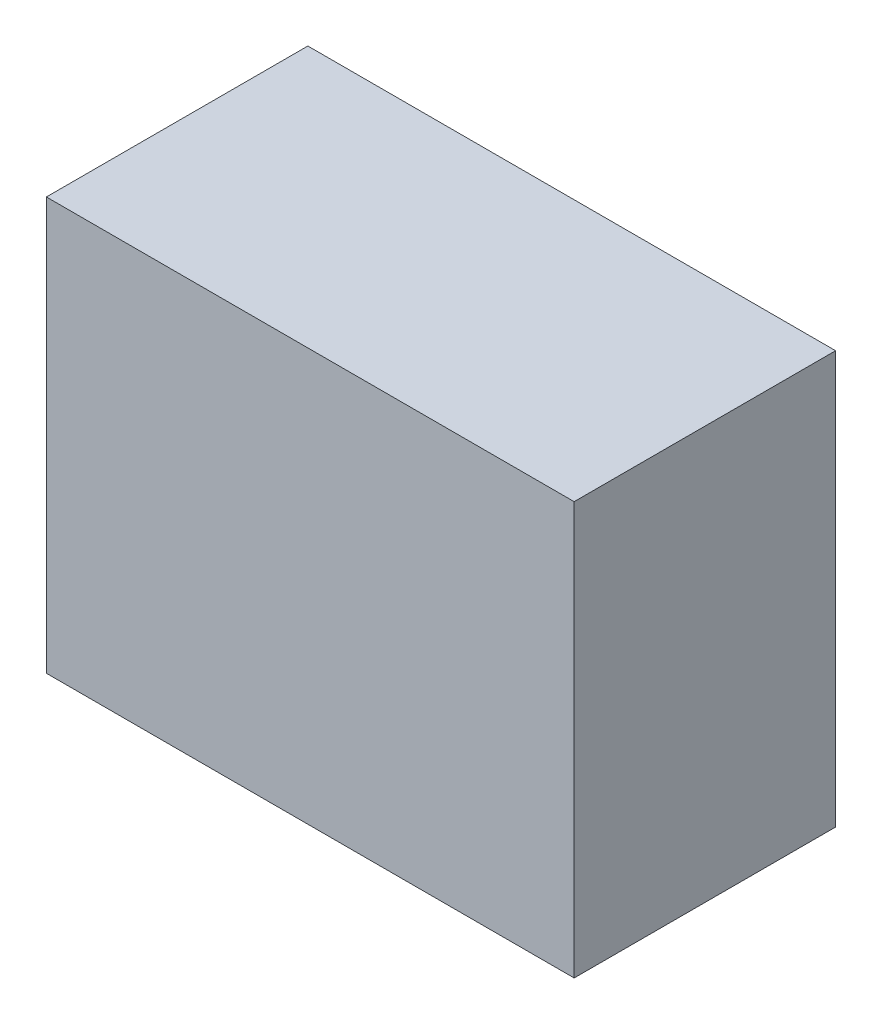
from build123d import *

# Parameters (mm, degrees)
SKETCH1_W           = 45.8
SKETCH1_H           = 35.8
SKETCH1_W_2         = 45
SKETCH1_H_2         = 35
BOSS_EXTRUDE1_DEPTH = 22.14
SKETCH2_W           = 45.8
SKETCH2_H           = 35.8
BOSS_EXTRUDE2_DEPTH = 0.55


with BuildPart() as part:
    # Sketch1 → Boss-Extrude1 (new body)
    with BuildSketch(Plane.XY):
        with Locations((22.5, 17.5)):
            Rectangle(SKETCH1_W, SKETCH1_H)
        with Locations((22.5, 17.5)):
            Rectangle(SKETCH1_W_2, SKETCH1_H_2, mode=Mode.SUBTRACT)
    extrude(amount=BOSS_EXTRUDE1_DEPTH)

    # Sketch2 → Boss-Extrude2 (add)
    with BuildSketch(Plane.XY.offset(22.14)):
        with Locations((22.5, 17.5)):
            Rectangle(SKETCH2_W, SKETCH2_H)
    extrude(amount=BOSS_EXTRUDE2_DEPTH)


solid = part.part
